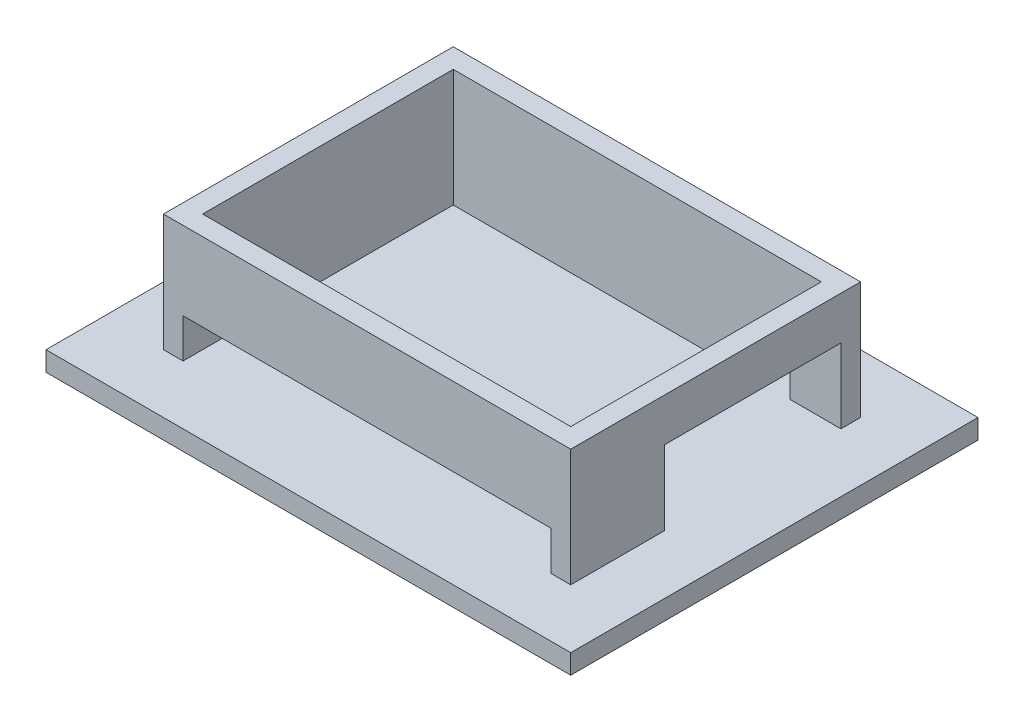
from build123d import *

# Parameters (mm, degrees)
SKETCH3_W           = 134
SKETCH3_H           = 104
SKETCH3_W_2         = 94
SKETCH3_H_2         = 64
BOSS_EXTRUDE2_DEPTH = 35
SKETCH3_6_W         = 94
SKETCH3_6_H         = 64
BOSS_EXTRUDE3_DEPTH = 5
SKETCH8_W           = 134
SKETCH8_H           = 104
SKETCH8_W_2         = 104
SKETCH8_H_2         = 74
CUT_EXTRUDE3_DEPTH  = 30
CUT_EXTRUDE4_DEPTH  = 114
SKETCH9_W           = 94
SKETCH9_H           = 10
CUT_EXTRUDE5_DEPTH  = 5
SKETCH10_W          = 17
SKETCH10_H          = 10
CUT_EXTRUDE6_DEPTH  = 5
SKETCH11_W          = 28.983298244
SKETCH11_H          = 12.432282013
BOSS_EXTRUDE4_DEPTH = 5
SKETCH13_W          = 12
SKETCH13_H          = 6
CUT_EXTRUDE7_DEPTH  = 10


with BuildPart() as part:
    # Sketch3 → Boss-Extrude2 (new body)
    with BuildSketch(Plane(origin=(0, 0, 0), x_dir=(1, 0, 0), z_dir=(0, 1, 0))):
        Rectangle(SKETCH3_W, SKETCH3_H)
        Rectangle(SKETCH3_W_2, SKETCH3_H_2, mode=Mode.SUBTRACT)
    extrude(amount=BOSS_EXTRUDE2_DEPTH)

    # Sketch3<6> → Boss-Extrude3 (add)
    with BuildSketch(Plane(origin=(0, 0, 0), x_dir=(1, 0, 0), z_dir=(0, 1, 0))):
        Rectangle(SKETCH3_6_W, SKETCH3_6_H)
    extrude(amount=BOSS_EXTRUDE3_DEPTH)

    # Sketch8 → Cut-Extrude3 (cut)
    with BuildSketch(Plane(origin=(0, 35, 0), x_dir=(1, 0, 0), z_dir=(0, 1, 0))):
        Rectangle(SKETCH8_W, SKETCH8_H)
        Rectangle(SKETCH8_W_2, SKETCH8_H_2, mode=Mode.SUBTRACT)
    extrude(amount=-CUT_EXTRUDE3_DEPTH, mode=Mode.SUBTRACT)

    # Sketch5 → Cut-Extrude4 (cut)
    with BuildSketch(Plane(origin=(67, 0, 0), x_dir=(0, 0, -1), z_dir=(1, 0, 0))):
        Polygon((32, 5.263033051), (32, 24), (-13, 24), (-13, 5), (32, 5), align=None)
    extrude(amount=-CUT_EXTRUDE4_DEPTH, mode=Mode.SUBTRACT)

    # Sketch9 → Cut-Extrude5 (cut)
    with BuildSketch(Plane.XY.offset(37)):
        with Locations((0, 10)):
            Rectangle(SKETCH9_W, SKETCH9_H)
    extrude(amount=-CUT_EXTRUDE5_DEPTH, mode=Mode.SUBTRACT)

    # Sketch10 → Cut-Extrude6 (cut)
    with BuildSketch(Plane(origin=(0, 0, -37), x_dir=(-1, 0, 0), z_dir=(0, 0, -1))):
        with Locations((-38.5, 10)):
            Rectangle(SKETCH10_W, SKETCH10_H)
    extrude(amount=-CUT_EXTRUDE6_DEPTH, mode=Mode.SUBTRACT)

    # Sketch11 → Boss-Extrude4 (add)
    with BuildSketch(Plane(origin=(0, 0, -37), x_dir=(-1, 0, 0), z_dir=(0, 0, -1))):
        with Locations((-34.333019182, 11.216141007)):
            Rectangle(SKETCH11_W, SKETCH11_H)
    extrude(amount=-BOSS_EXTRUDE4_DEPTH)

    # Sketch13 → Cut-Extrude7 (cut)
    with BuildSketch(Plane(origin=(0, 0, -37), x_dir=(-1, 0, 0), z_dir=(0, 0, -1))):
        with Locations((-33, 8)):
            Rectangle(SKETCH13_W, SKETCH13_H)
    extrude(amount=-CUT_EXTRUDE7_DEPTH, mode=Mode.SUBTRACT)


solid = part.part
